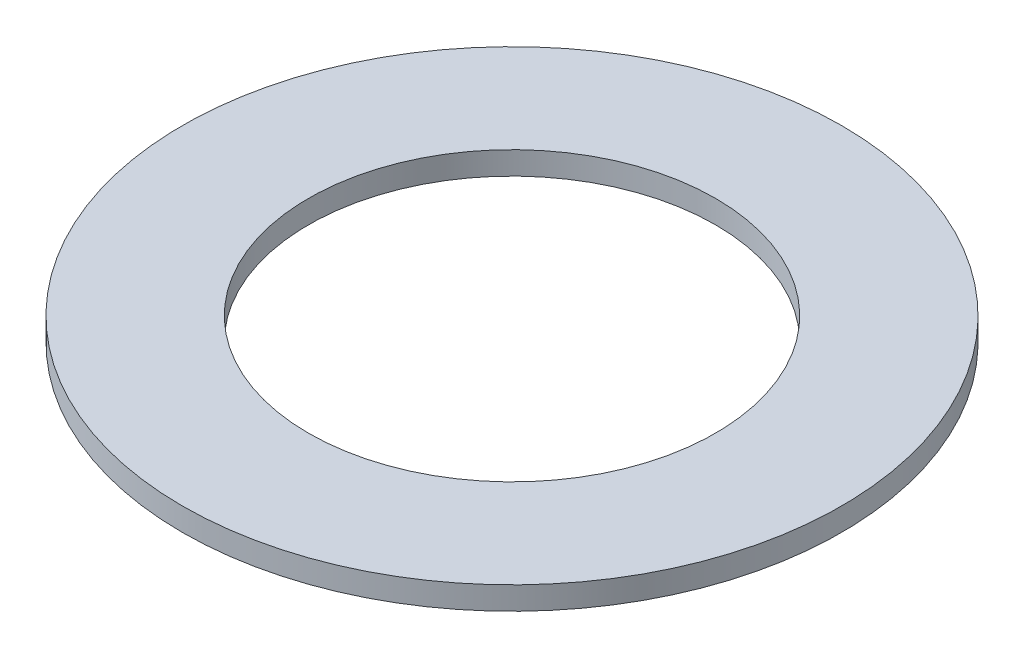
from build123d import *

# Parameters (mm, degrees)
SKETCH1_R           = 5.75
SKETCH1_R_2         = 3.55
BOSS_EXTRUDE1_DEPTH = 0.4


with BuildPart() as part:
    # Sketch1 → Boss-Extrude1 (new body)
    with BuildSketch(Plane(origin=(0, 0, 0), x_dir=(1, 0, 0), z_dir=(0, 1, 0))):
        with Locations(Location((0, 0, 0), (0, 0, 270))):
            Circle(SKETCH1_R)
        with Locations(Location((0, 0, 0), (0, 0, 270))):
            Circle(SKETCH1_R_2, mode=Mode.SUBTRACT)
    extrude(amount=BOSS_EXTRUDE1_DEPTH)


solid = part.part
